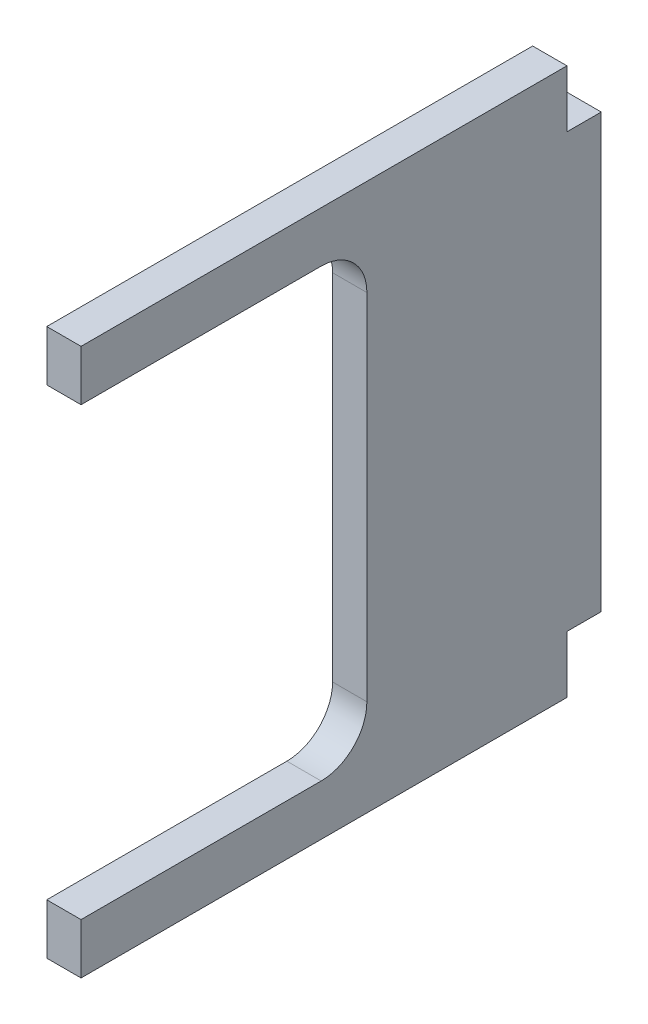
from build123d import *

# Parameters (mm, degrees)
ESTRUSIONE_ESTRUSIONE1_DEPTH      = 17.5
ESTRUSIONE_ESTRUSIONE1_DEPTH_BACK = 3
SCHIZZO1_W                        = 3
SCHIZZO1_H                        = 37.84787706
SCHIZZO2_W                        = 3
SCHIZZO2_H                        = 42.5
ESTRUSIONE_ESTRUSIONE2_DEPTH      = 5
SCHIZZO3_W                        = 25
SCHIZZO3_H                        = 0.57606147
TAGLIO_ESTRUSIONE1_DEPTH          = 10
RACCORDO1_R                       = 4
RACCORDO1_OF_SPECCHIA1_R          = 4


with BuildPart() as part:
    # Schizzo1 → Estrusione-Estrusione1 (new, two sides: drawn at the far end of the back side and taken through both)
    with BuildSketch(Plane.XY.offset(-ESTRUSIONE_ESTRUSIONE1_DEPTH_BACK)):
        with Locations((-225, 0)):
            Rectangle(SCHIZZO1_W, SCHIZZO1_H)
    extrude(amount=ESTRUSIONE_ESTRUSIONE1_DEPTH + ESTRUSIONE_ESTRUSIONE1_DEPTH_BACK)

    # Schizzo2 → Estrusione-Estrusione2 (add)
    with BuildSketch(Plane(origin=(0, 18.92393853, 0), x_dir=(1, 0, 0), z_dir=(0, 1, 0))):
        with Locations((-225, -21.25)):
            Rectangle(SCHIZZO2_W, SCHIZZO2_H)
    estrusione_estrusione2 = extrude(amount=ESTRUSIONE_ESTRUSIONE2_DEPTH)

    # Schizzo3 → Taglio-Estrusione1 (cut)
    with BuildSketch(Plane(origin=(-223.5, 0, 0), x_dir=(0, 0, -1), z_dir=(1, 0, 0))):
        with Locations((-30, 19.211969265)):
            Rectangle(SCHIZZO3_W, SCHIZZO3_H)
    taglio_estrusione1 = extrude(amount=-TAGLIO_ESTRUSIONE1_DEPTH, mode=Mode.SUBTRACT)

    # Raccordo1
    raccordo1_edges = [part.edges().sort_by_distance(p)[0] for p in [
        (-225, 19.5, 17.5),
    ]]
    fillet(raccordo1_edges, radius=RACCORDO1_R)

    # Specchia1: Estrusione-Estrusione2, Taglio-Estrusione1 across plane
    add(estrusione_estrusione2.mirror(Plane.ZX))
    add(taglio_estrusione1.mirror(Plane.ZX), mode=Mode.SUBTRACT)

    # Raccordo1 of Specchia1
    raccordo1_of_specchia1_edges = [part.edges().sort_by_distance(p)[0] for p in [
        (-225, -19.5, 17.5),
    ]]
    fillet(raccordo1_of_specchia1_edges, radius=RACCORDO1_OF_SPECCHIA1_R)


solid = part.part
